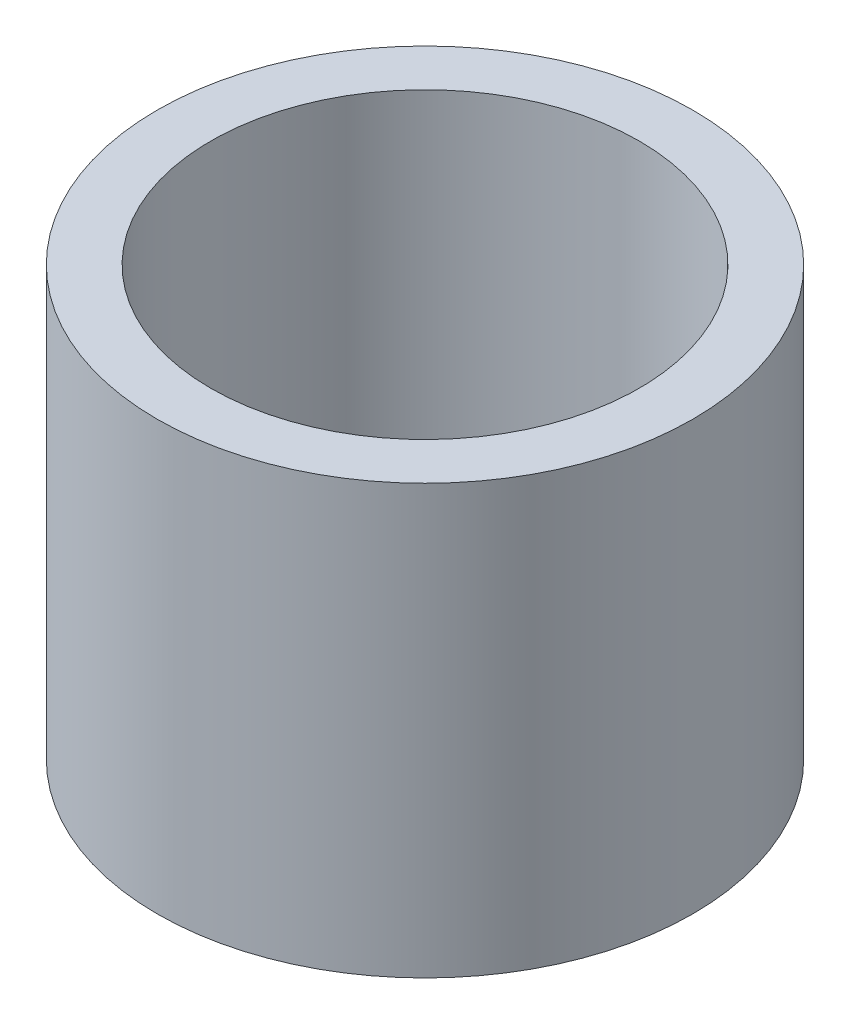
from build123d import *

# Parameters (mm, degrees)
SKETCH1_R           = 31.75
SKETCH1_R_2         = 25.4
BOSS_EXTRUDE1_DEPTH = 50.8


with BuildPart() as part:
    # Sketch1 → Boss-Extrude1 (new body)
    with BuildSketch(Plane(origin=(0, 0, 0), x_dir=(1, 0, 0), z_dir=(0, 1, 0))):
        with Locations(Location((0, 0, 0), (0, 0, 270))):
            Circle(SKETCH1_R)
        with Locations(Location((0, 0, 0), (0, 0, 270))):
            Circle(SKETCH1_R_2, mode=Mode.SUBTRACT)
    extrude(amount=BOSS_EXTRUDE1_DEPTH)


solid = part.part
